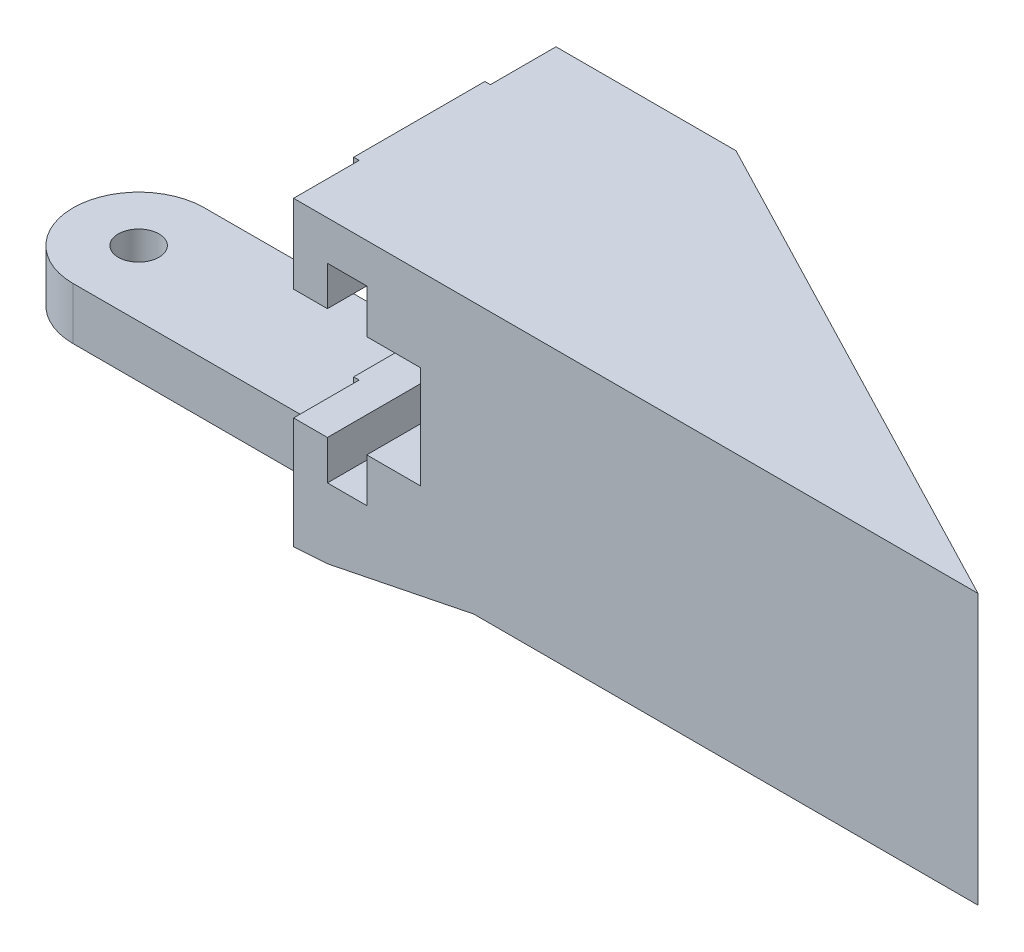
from build123d import *

# Parameters (mm, degrees)
EXTRUDE_1_DEPTH          = 20
CUT_EXTRUDE_1_DEPTH      = 49.817301935
CUT_EXTRUDE_1_DEPTH_BACK = 49.817301935
CUT_EXTRUDE_2_DEPTH      = 50.88447801
CUT_EXTRUDE_2_DEPTH_BACK = 50.88447801
SKETCH_3_W               = 26.81134726
SKETCH_3_H               = 5
CUT_EXTRUDE_3_DEPTH      = 50.88447801
CUT_EXTRUDE_3_DEPTH_BACK = 50.88447801
SKETCH_4_R               = 1.55


with BuildPart() as part:
    # 草图1 → 凸台-拉伸1 (new body)
    with BuildSketch(Plane.XY):
        Polygon((-13.100304314, 11.5), (39.490013248, 11.5), (39.490013248, -9.083192704), (1.044300056, -9.083192704), (-7.416317872, -10.795276425), (-10.024002967, -11.323036202), (-12.678665988, -11.5), (-39.490013248, -11.5), (-39.490013248, -7.536083067), (-13.100304314, -7.5), (-13.100304314, -3), (-10.100304314, -3), (-10.100304314, -6), (-7.100304314, -6), (-7.100304314, -2.65), (-3.000304314, -2.65), (-3.000304314, 5.15), (-7.100304314, 5.15), (-7.100304314, 8.5), (-10.100304314, 8.5), (-10.100304314, 5.5), (-13.100304314, 5.5), align=None)
    extrude(amount=EXTRUDE_1_DEPTH)

    # 草图2 → 切除-拉伸1 (cut, two sides: drawn at the far end of the back side and taken through both)
    with BuildSketch(Plane.XZ.offset(9.083192704).offset(-CUT_EXTRUDE_1_DEPTH_BACK)):
        Polygon((39.490013248, 20), (39.490013248, 0), (1.044300056, 0), align=None)
    extrude(amount=CUT_EXTRUDE_1_DEPTH + CUT_EXTRUDE_1_DEPTH_BACK, mode=Mode.SUBTRACT)

    # 草图3 → 切除-拉伸2 (cut, two sides: drawn at the far end of the back side and taken through both)
    with BuildSketch(Plane.XZ.offset(11.5).offset(-CUT_EXTRUDE_2_DEPTH_BACK)):
        with Locations((-26.084339618, 17.5)):
            Rectangle(SKETCH_3_W, SKETCH_3_H)
        with Locations((-26.084339618, 2.5)):
            Rectangle(SKETCH_3_W, SKETCH_3_H)
    extrude(amount=CUT_EXTRUDE_2_DEPTH + CUT_EXTRUDE_2_DEPTH_BACK, mode=Mode.SUBTRACT)

    # 草图4 → 切除-拉伸3 (cut, two sides: drawn at the far end of the back side and taken through both)
    with BuildSketch(Plane.XZ.offset(11.5).offset(-CUT_EXTRUDE_3_DEPTH_BACK)):
        with BuildLine():
            Line((-34.490013248, 15), (-39.490013248, 15))
            Line((-39.490013248, 15), (-39.490013248, 10))
            ThreePointArc((-39.490013248, 10), (-38.025547154, 13.535533906), (-34.490013248, 15))
        make_face()
        with Locations(Location((-34.490013248, 10, 0), (0, 0, 180))):
            Circle(SKETCH_4_R)
        with BuildLine():
            ThreePointArc((-34.490013248, 5), (-38.025547154, 6.464466094), (-39.490013248, 10))
            Line((-39.490013248, 10), (-39.490013248, 5))
            Line((-39.490013248, 5), (-34.490013248, 5))
        make_face()
    extrude(amount=CUT_EXTRUDE_3_DEPTH + CUT_EXTRUDE_3_DEPTH_BACK, mode=Mode.SUBTRACT)


solid = part.part
